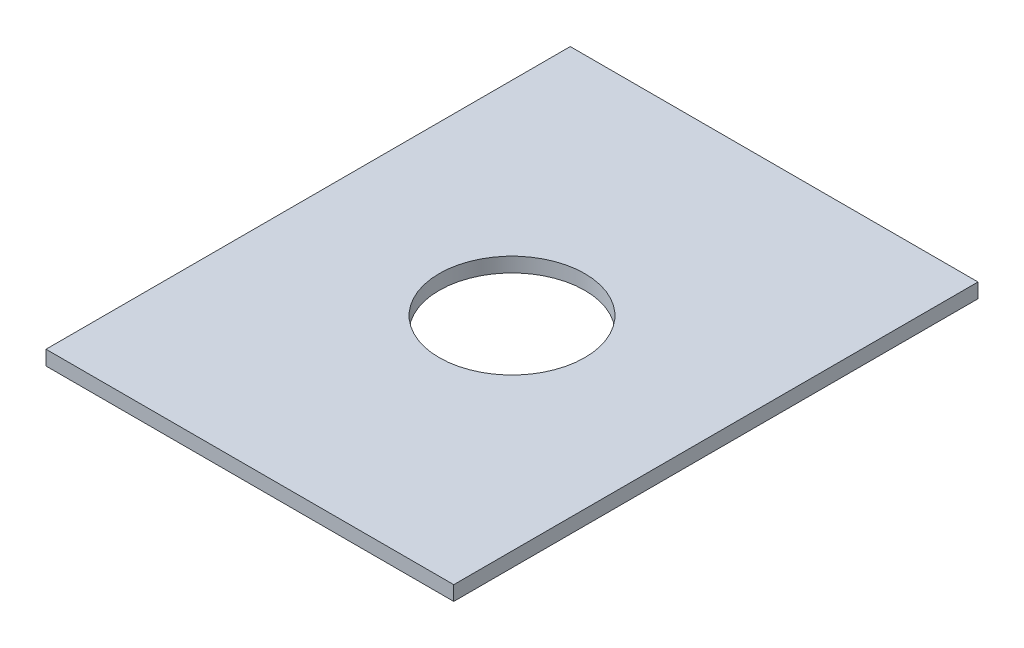
from build123d import *

# Parameters (mm, degrees)
SKETCH1_W           = 140
SKETCH1_H           = 180
BOSS_EXTRUDE1_DEPTH = 5
SKETCH2_R           = 25
CUT_EXTRUDE1_DEPTH  = 115.127122105


with BuildPart() as part:
    # Sketch1 → Boss-Extrude1 (new body)
    with BuildSketch(Plane(origin=(0, 0, 0), x_dir=(1, 0, 0), z_dir=(0, 1, 0))):
        Rectangle(SKETCH1_W, SKETCH1_H)
    extrude(amount=BOSS_EXTRUDE1_DEPTH)

    # Sketch2 → Cut-Extrude1 (cut, through all)
    with BuildSketch(Plane(origin=(0, 5, 0), x_dir=(1, 0, 0), z_dir=(0, 1, 0))):
        with Locations(Location((0, 0, 0), (0, 0, 270))):
            Circle(SKETCH2_R)
    extrude(amount=-CUT_EXTRUDE1_DEPTH, mode=Mode.SUBTRACT)


solid = part.part
